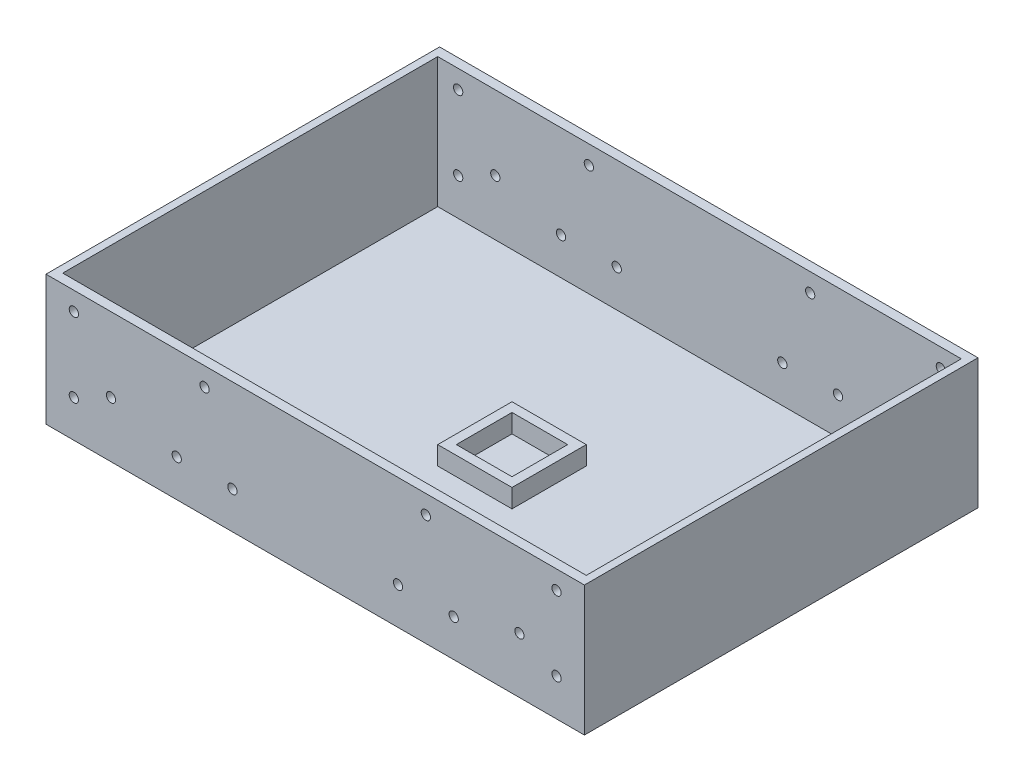
from build123d import *

# Parameters (mm, degrees)
SKETCH1_W                                  = 290
SKETCH1_H                                  = 212
BOSS_EXTRUDE1_DEPTH                        = 10
SKETCH2_W                                  = 290
SKETCH2_H                                  = 212
SKETCH2_W_2                                = 282
SKETCH2_H_2                                = 202
BOSS_EXTRUDE2_DEPTH                        = 70
SKETCH3_W                                  = 6
SKETCH3_H                                  = 202
SKETCH3_W_2                                = 40
SKETCH3_H_2                                = 40
SKETCH3_W_3                                = 30
SKETCH3_H_3                                = 30
BOSS_EXTRUDE3_DEPTH                        = 10
CHAMFER1_SIZE                              = 10
SKETCH4_R                                  = 2.5
CUT_EXTRUDE1_DEPTH                         = 207
SKETCH5_R                                  = 2.5
CUT_EXTRUDE2_DEPTH                         = 270.014869478
MIRROR2_AT_THE_SECOND_PLANE_COPY_1_SKETC_R = 2.5
MIRROR2_AT_THE_SECOND_PLANE_COPY_1_DEPTH   = 207


with BuildPart() as part:
    # Sketch1 → Boss-Extrude1 (new body)
    with BuildSketch(Plane(origin=(0, 0, 0), x_dir=(1, 0, 0), z_dir=(0, 1, 0))):
        Rectangle(SKETCH1_W, SKETCH1_H)
    extrude(amount=BOSS_EXTRUDE1_DEPTH)

    # Sketch2 → Boss-Extrude2 (add)
    with BuildSketch(Plane(origin=(0, 10, 0), x_dir=(1, 0, 0), z_dir=(0, 1, 0))):
        Rectangle(SKETCH2_W, SKETCH2_H)
        Rectangle(SKETCH2_W_2, SKETCH2_H_2, mode=Mode.SUBTRACT)
    extrude(amount=BOSS_EXTRUDE2_DEPTH)

    # Sketch3 → Boss-Extrude3 (add)
    # profile 1 of 2: a face of its own
    with BuildSketch(Plane(origin=(0, 10, 0), x_dir=(1, 0, 0), z_dir=(0, 1, 0))):
        with Locations((138, 0)):
            Rectangle(SKETCH3_W, SKETCH3_H)
    # profile 2 of 2: a face of its own
    with BuildSketch(Plane(origin=(0, 10, 0), x_dir=(1, 0, 0), z_dir=(0, 1, 0))):
        Rectangle(SKETCH3_W_2, SKETCH3_H_2)
        Rectangle(SKETCH3_W_3, SKETCH3_H_3, mode=Mode.SUBTRACT)
    extrude(amount=BOSS_EXTRUDE3_DEPTH)

    # Chamfer1
    chamfer1_edges = [part.edges().sort_by_distance(p)[0] for p in [
        (0, 0, 106),
        (-145, 0, 0),
        (0, 0, -106),
        (145, 0, 0),
    ]]
    chamfer(chamfer1_edges, length=CHAMFER1_SIZE)

    # Sketch4 → Cut-Extrude1 (cut)
    with BuildSketch(Plane.XY.offset(106)):
        with Locations((-44.6, 30)):
            Circle(SKETCH4_R)
        with Locations((-74.6, 30)):
            Circle(SKETCH4_R)
        with Locations((-59.6, 70)):
            Circle(SKETCH4_R)
    cut_extrude1 = extrude(amount=-CUT_EXTRUDE1_DEPTH, mode=Mode.SUBTRACT)

    # Sketch5 → Cut-Extrude2 (cut, through all)
    with BuildSketch(Plane.XY.offset(106)):
        with Locations((-130, 70)):
            Circle(SKETCH5_R)
        with Locations((-130, 30)):
            Circle(SKETCH5_R)
        with Locations((-110, 40)):
            Circle(SKETCH5_R)
    cut_extrude2 = extrude(amount=-CUT_EXTRUDE2_DEPTH, mode=Mode.SUBTRACT)

    # Mirror1: Cut-Extrude2 across plane
    add(cut_extrude2.mirror(Plane(origin=(0, 0, 0), x_dir=(0, 0, 1), z_dir=(1, 0, 0))), mode=Mode.SUBTRACT)

    # Mirror2: Cut-Extrude1 across plane
    add(cut_extrude1.mirror(Plane(origin=(0, 0, 0), x_dir=(0, 0, 1), z_dir=(1, 0, 0))), mode=Mode.SUBTRACT)

    # Mirror2 at the second plane: Cut-Extrude1 across plane
    add(cut_extrude1.mirror(Plane.XY), mode=Mode.SUBTRACT)

    # Mirror2 at the second plane copy 1 sketc → Mirror2 at the second plane copy 1 (cut)
    with BuildSketch(Plane(origin=(0, 0, -106), x_dir=(-1, 0, 0), z_dir=(0, 0, -1))):
        with Locations((-44.6, 30)):
            Circle(MIRROR2_AT_THE_SECOND_PLANE_COPY_1_SKETC_R)
        with Locations((-74.6, 30)):
            Circle(MIRROR2_AT_THE_SECOND_PLANE_COPY_1_SKETC_R)
        with Locations((-59.6, 70)):
            Circle(MIRROR2_AT_THE_SECOND_PLANE_COPY_1_SKETC_R)
    extrude(amount=-MIRROR2_AT_THE_SECOND_PLANE_COPY_1_DEPTH, mode=Mode.SUBTRACT)


solid = part.part
